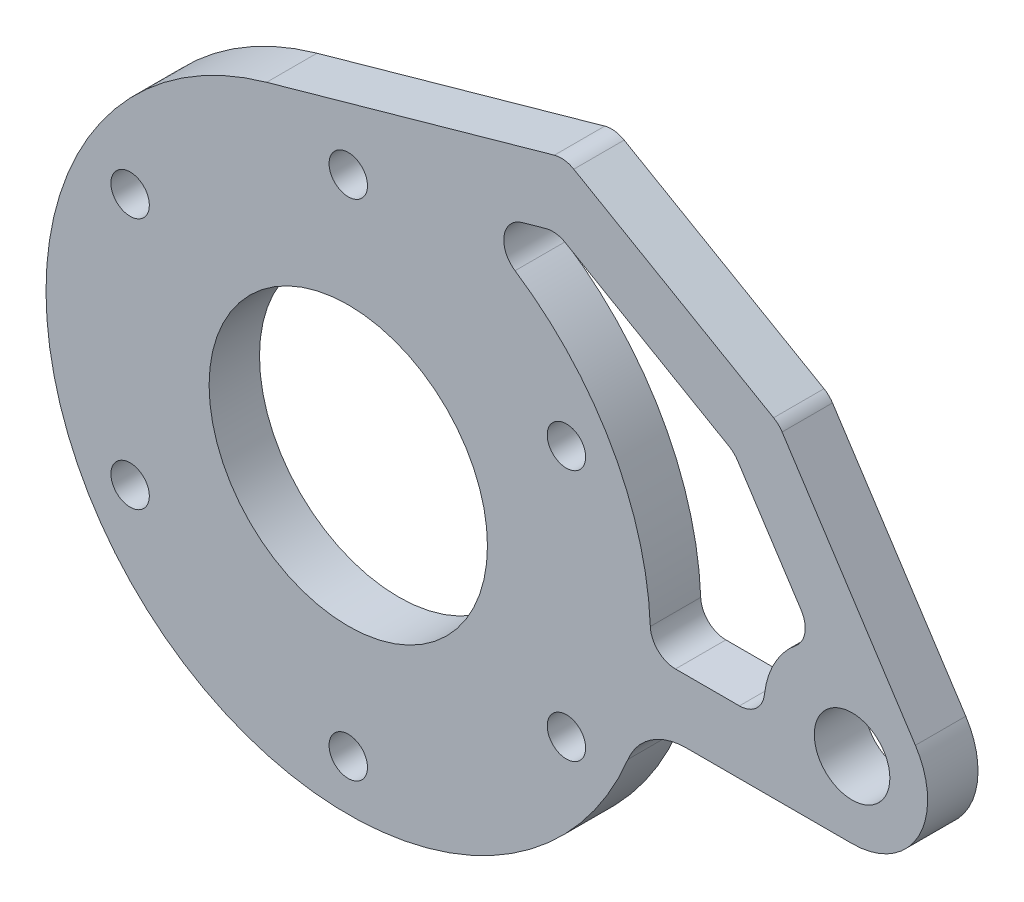
from build123d import *

# Parameters (mm, degrees)
SKETCH_1_R          = 24
SKETCH_1_R_2        = 11.05
EXTRUDE_1_DEPTH     = 4
EXTRUDE_START       = -4
SKETCH_2_R          = 3
EXTRUDE_2_DEPTH     = 4
EXTRUDE_3_DEPTH     = 4
FILLET_1_R          = 2
FILLET_2_R          = 5
SKETCH_4_R          = 1.525
CUT_EXTRUDE_1_DEPTH = 4
CUT_EXTRUDE_START   = -4
CUT_EXTRUDE_2_DEPTH = 4
FILLET_3_R          = 2


with BuildPart() as part:
    # 草图1 → 凸台-拉伸1 (new body)
    with BuildSketch(Plane.XY):
        Circle(SKETCH_1_R)
        Circle(SKETCH_1_R_2, mode=Mode.SUBTRACT)
    extrude(amount=EXTRUDE_1_DEPTH)

    # 草图2 → 凸台-拉伸2 (add)
    with BuildSketch(Plane.XY.offset(4).offset(EXTRUDE_START)):
        with BuildLine():
            Line((40, 6), (23.237900077, 6))
            ThreePointArc((23.237900077, 6), (24, 0), (23.237900077, -6))
            Line((23.237900077, -6), (40, -6))
            ThreePointArc((40, -6), (46, 0), (40, 6))
        make_face()
        with Locations((40, 0)):
            Circle(SKETCH_2_R, mode=Mode.SUBTRACT)
    extrude(amount=EXTRUDE_2_DEPTH)

    # 草图3 → 凸台-拉伸3 (add)
    with BuildSketch(Plane.XY.offset(4).offset(EXTRUDE_START)):
        with BuildLine():
            Line((34.185278485, 19.927083758), (17.175, 29.74797262))
            Line((17.175, 29.74797262), (-6.485541404, 23.107093125))
            ThreePointArc((-6.485541404, 23.107093125), (11.971780948, 20.800876446), (23.237900077, 6))
            Line((23.237900077, 6), (40, 6))
            ThreePointArc((40, 6), (42.859825808, 5.274599165), (45.028144939, 3.273798783))
            Line((45.028144939, 3.273798783), (34.185278485, 19.927083758))
        make_face()
    extrude(amount=EXTRUDE_3_DEPTH)

    # 圆角1
    fillet_1_edges = [part.edges().sort_by_distance(p)[0] for p in [
        (34.185278485, 19.927083758, 2),
        (17.175, 29.74797262, 2),
    ]]
    fillet(fillet_1_edges, radius=FILLET_1_R)

    # 圆角2
    fillet_2_edges = [part.edges().sort_by_distance(p)[0] for p in [
        (23.237900077, -6, 2),
    ]]
    fillet(fillet_2_edges, radius=FILLET_2_R)

    # 草图4 → 切除-拉伸1 (cut)
    with BuildSketch(Plane.XY.offset(4)):
        with Locations((0, 20)):
            Circle(SKETCH_4_R)
        with Locations((17.320508076, 10)):
            Circle(SKETCH_4_R)
        with Locations((17.320508076, -10)):
            Circle(SKETCH_4_R)
        with Locations((0, -20)):
            Circle(SKETCH_4_R)
        with Locations((-17.320508076, -10)):
            Circle(SKETCH_4_R)
        with Locations((-17.320508076, 10)):
            Circle(SKETCH_4_R)
    extrude(amount=-CUT_EXTRUDE_1_DEPTH, mode=Mode.SUBTRACT)

    # 草图5 → 切除-拉伸2 (cut)
    with BuildSketch(Plane.XY.offset(4).offset(CUT_EXTRUDE_START)):
        with BuildLine():
            Line((8.982966985, 22.25547807), (16.498687329, 24.36493923))
            Line((16.498687329, 24.36493923), (30.648421839, 16.195586202))
            Line((30.648421839, 16.195586202), (37.057766939, 6.351634799))
            ThreePointArc((37.057766939, 6.351634799), (33.846300974, 3.336463442), (33.07179677, -1))
            Line((33.07179677, -1), (23.979157617, -1))
            ThreePointArc((23.979157617, -1), (20.170020566, 13.006547211), (8.982966985, 22.25547807))
        make_face()
    extrude(amount=CUT_EXTRUDE_2_DEPTH, mode=Mode.SUBTRACT)

    # 圆角3
    fillet_3_edges = [part.edges().sort_by_distance(p)[0] for p in [
        (23.979157617, -1, 2),
        (8.982966985, 22.25547807, 2),
        (16.498687329, 24.36493923, 2),
        (30.648421839, 16.195586202, 2),
        (37.057766939, 6.351634799, 2),
        (33.07179677, -1, 2),
    ]]
    fillet(fillet_3_edges, radius=FILLET_3_R)


solid = part.part
